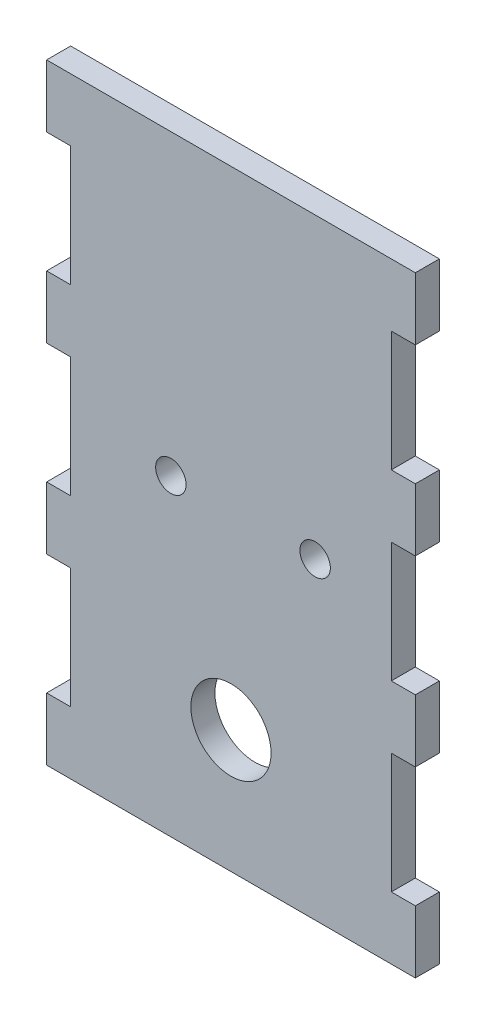
from build123d import *

# Parameters (mm, degrees)
SKETCH1_W             = 46
SKETCH1_H             = 76.2
BOSS_EXTRUDE1_DEPTH   = 3
SKETCH2_W             = 3
SKETCH2_H             = 15
CUT_EXTRUDE1_DEPTH    = 73.446802019
LPATTERN1_COUNT       = 3
LPATTERN1_PITCH       = 22.8
F_6_CLEARANCE_HOLE1_D = 3.7973
CUT_EXTRUDE2_REACH    = 74.447
SKETCH5_R             = 5


with BuildPart() as part:
    # Sketch1 → Boss-Extrude1 (new body)
    with BuildSketch(Plane.XY):
        with Locations((-17.993460648, -21.557986111)):
            Rectangle(SKETCH1_W, SKETCH1_H)
    extrude(amount=BOSS_EXTRUDE1_DEPTH)

    # Sketch2 → Cut-Extrude1 (cut, through all)
    with BuildSketch(Plane.XY.offset(3)):
        with Locations((-39.493460648, 1.242013889)):
            Rectangle(SKETCH2_W, SKETCH2_H)
        with Locations((3.506539352, 1.242013889)):
            Rectangle(SKETCH2_W, SKETCH2_H)
    cut_extrude1 = extrude(amount=-CUT_EXTRUDE1_DEPTH, mode=Mode.SUBTRACT)

    # LPattern1: Cut-Extrude1 ×3
    with Locations(*[(0, -i * LPATTERN1_PITCH, 0) for i in range(1, LPATTERN1_COUNT)]):
        add(cut_extrude1, mode=Mode.SUBTRACT)

    # #6 Clearance Hole1 (through all)
    with Locations(Plane.XY.offset(3)):
        with Locations((-25.493460648, -20.657986111), (-7.493460648, -20.657986111)):
            Hole(F_6_CLEARANCE_HOLE1_D / 2)

    # Sketch5 → Cut-Extrude2 (cut, up to next)
    with BuildSketch(Plane(origin=(0, 0, 0), x_dir=(-1, 0, 0), z_dir=(0, 0, -1)), mode=Mode.PRIVATE) as cut_extrude2_sk1:
        with Locations((17.993460648, -44.357986111)):
            Circle(SKETCH5_R)
    cut_extrude2_tool1 = extrude(cut_extrude2_sk1.sketch, amount=-CUT_EXTRUDE2_REACH, mode=Mode.PRIVATE) & part.part
    add(cut_extrude2_tool1.solids().sort_by_distance((-17.993461, -44.357986, 0))[0], mode=Mode.SUBTRACT)


solid = part.part
